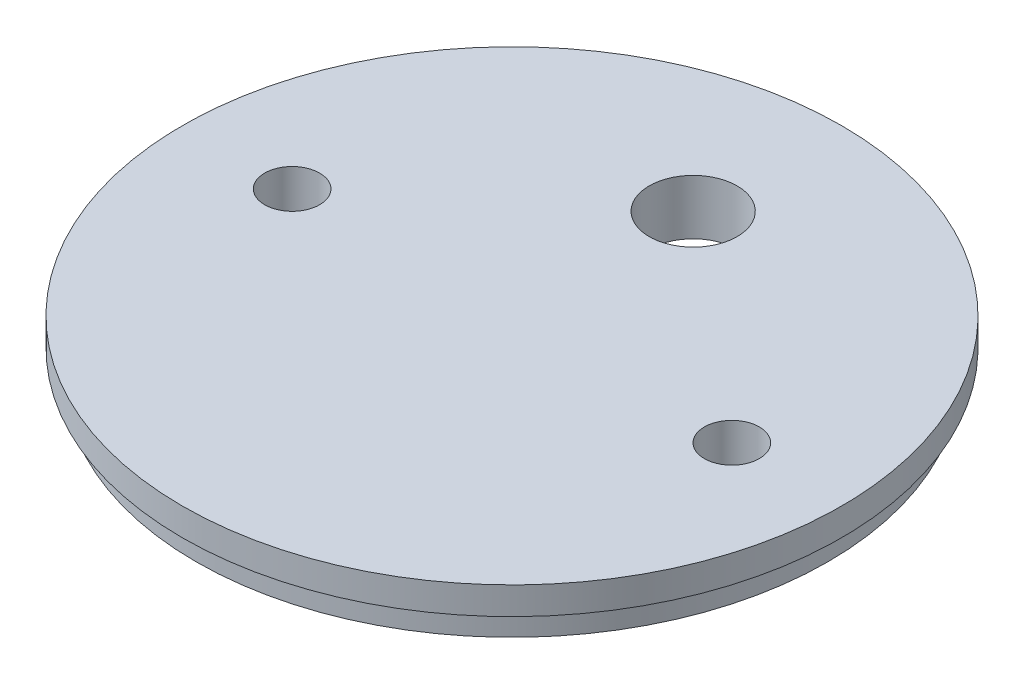
from build123d import *

# Parameters (mm, degrees)
SKETCH1_R           = 36.5125
BOSS_EXTRUDE1_DEPTH = 3.175
SKETCH2_R           = 38.0746
BOSS_EXTRUDE2_DEPTH = 3.175
SKETCH3_R           = 5.08
CUT_EXTRUDE1_DEPTH  = 55.218749804
SKETCH7_R           = 3.175
CUT_EXTRUDE4_DEPTH  = 55.218749804


with BuildPart() as part:
    # Sketch1 → Boss-Extrude1 (new body)
    with BuildSketch(Plane(origin=(0, 0, 0), x_dir=(1, 0, 0), z_dir=(0, 1, 0))):
        with Locations(Location((0, 0, 0), (0, 0, 270))):
            Circle(SKETCH1_R)
    extrude(amount=BOSS_EXTRUDE1_DEPTH)

    # Sketch2 → Boss-Extrude2 (add)
    with BuildSketch(Plane(origin=(0, 3.175, 0), x_dir=(1, 0, 0), z_dir=(0, 1, 0))):
        with Locations(Location((0, 0, 0), (0, 0, 270))):
            Circle(SKETCH2_R)
    extrude(amount=BOSS_EXTRUDE2_DEPTH)

    # Sketch3 → Cut-Extrude1 (cut, through all)
    with BuildSketch(Plane.XZ):
        with Locations(Location((0, -20.9296, 0), (0, 0, 270))):
            Circle(SKETCH3_R)
    extrude(amount=-CUT_EXTRUDE1_DEPTH, mode=Mode.SUBTRACT)

    # Sketch7 → Cut-Extrude4 (cut, through all)
    with BuildSketch(Plane(origin=(0, 6.35, 0), x_dir=(1, 0, 0), z_dir=(0, 1, 0))):
        with Locations(Location((-25.4, 0, 0), (0, 0, 270))):
            Circle(SKETCH7_R)
        with Locations(Location((25.4, 0, 0), (0, 0, 270))):
            Circle(SKETCH7_R)
    extrude(amount=-CUT_EXTRUDE4_DEPTH, mode=Mode.SUBTRACT)


solid = part.part
